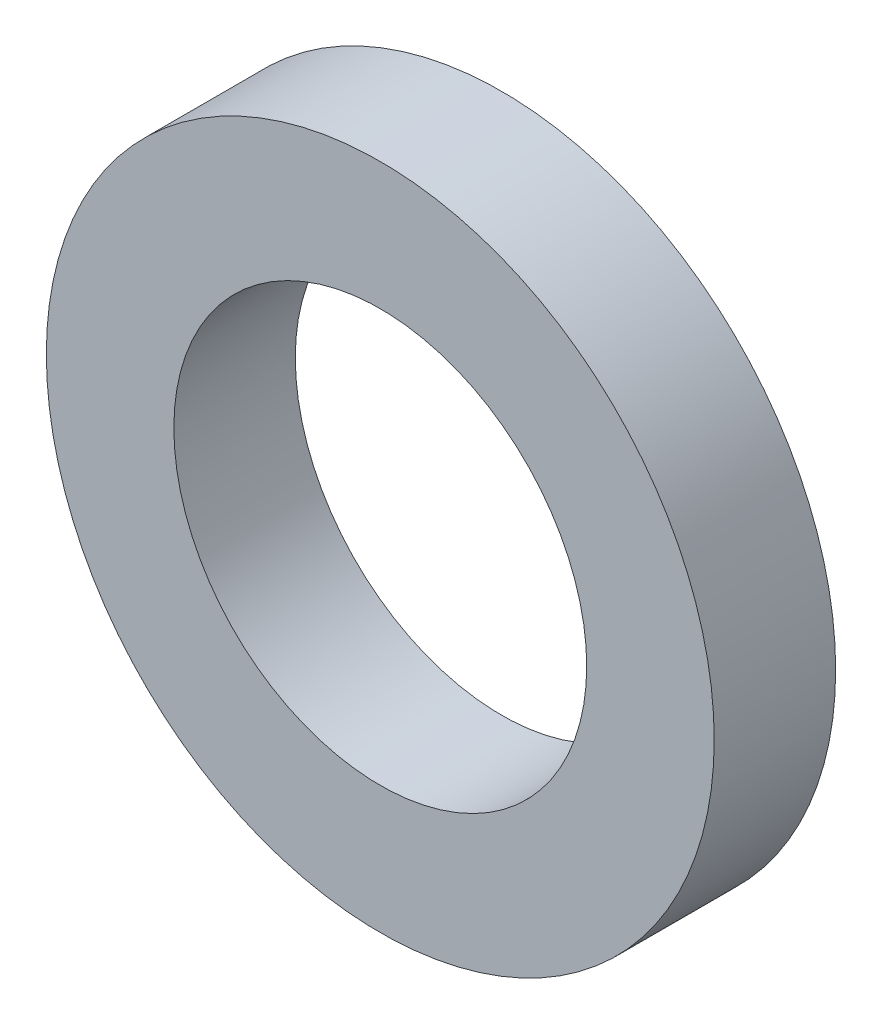
from build123d import *

# Parameters (mm, degrees)
SKETCH_1_R      = 2.75
SKETCH_1_R_2    = 1.7
EXTRUDE_1_DEPTH = 1


with BuildPart() as part:
    # 草图1 → 凸台-拉伸1 (new body)
    with BuildSketch(Plane.XY):
        Circle(SKETCH_1_R)
        Circle(SKETCH_1_R_2, mode=Mode.SUBTRACT)
    extrude(amount=EXTRUDE_1_DEPTH)


solid = part.part
